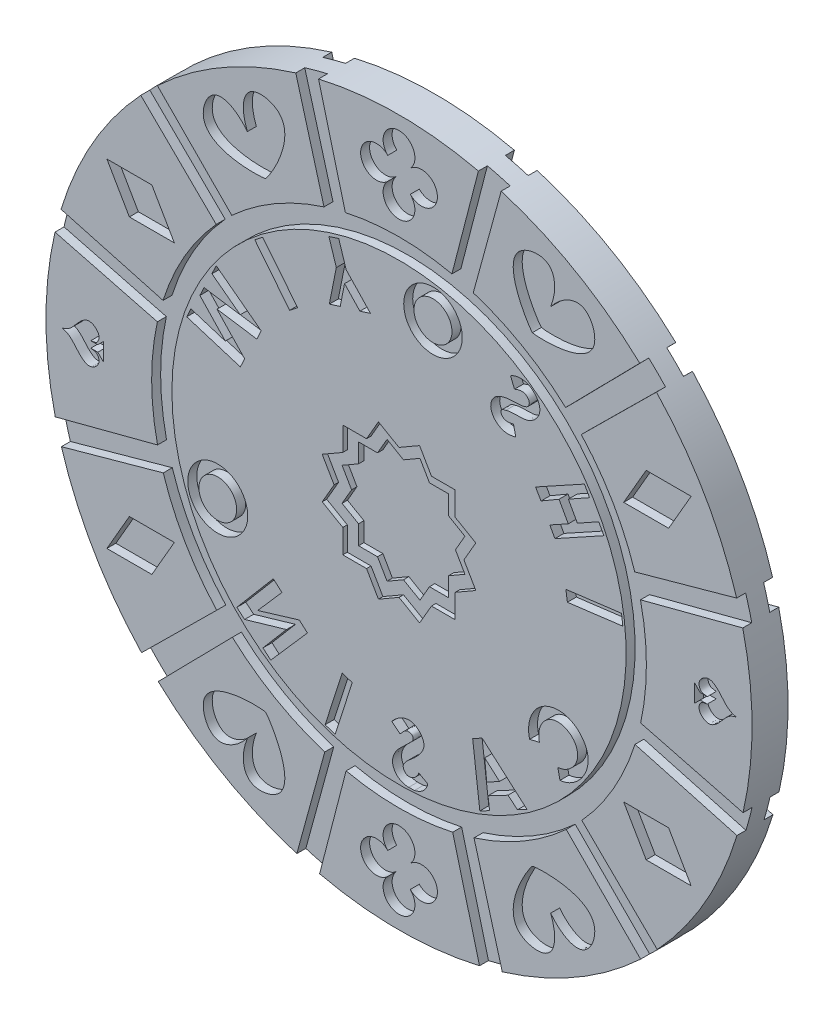
from build123d import *

# Parameters (mm, degrees)
SKETCH1_R           = 19.939
BOSS_EXTRUDE1_DEPTH = 2.032
CUT_EXTRUDE1_DEPTH  = 0.508
SKETCH3_R           = 1.693344305
SKETCH3_R_2         = 1.066307196
SKETCH3_R_3         = 1.653225877
SKETCH3_R_4         = 1.073076452
CUT_EXTRUDE2_DEPTH  = 0.508
SKETCH5_R           = 12.827
CUT_EXTRUDE3_DEPTH  = 0.508
SKETCH7_W           = 6.35
SKETCH7_H           = 6.35
CUT_EXTRUDE10_DEPTH = 0.254
SKETCH8_W           = 5.08
SKETCH8_H           = 5.08
CUT_EXTRUDE11_DEPTH = 0.3048


with BuildPart() as part:
    # Sketch1 → Boss-Extrude1 (new body)
    with BuildSketch(Plane.XY):
        Circle(SKETCH1_R)
    extrude(amount=BOSS_EXTRUDE1_DEPTH)

    # Sketch2 → Cut-Extrude1 (cut)
    with BuildSketch(Plane(origin=(0, 0, 0), x_dir=(-1, 0, 0), z_dir=(0, 0, -1))):
        Polygon((-13.957783942, 9.525), (-16.497783942, 9.525), (-15.227783942, 7.325295474), (-12.687783942, 7.325295474), align=None)
        with BuildLine():
            Line((-17.011621446, 0.182060851), (-17.408569341, 0.182060851))
            add(Edge.make_bspline(
                [(-19.05, 0), (-18.503239957, 0.097550383), (-18.264836671, 0.68419097), (-17.565831877, 1.168103901), (-17.119118499, 0.987392867), (-16.870713443, 0.631677268), (-17.05092236, 0.190580299), (-17.285542093, 0.21121167), (-17.408569341, 0.182060851)],
                knots=[0, 0, 0, 0, 0.410966466, 0.558537737, 0.671524426, 0.797338713, 0.904759417, 1, 1, 1, 1], degree=3))
            add(Edge.make_bspline(
                [(-19.05, 0), (-18.503239957, -0.097550383), (-18.264836671, -0.68419097), (-17.565831877, -1.168103901), (-17.119118499, -0.987392867), (-16.870713443, -0.631677268), (-17.05092236, -0.190580299), (-17.285542093, -0.21121167), (-17.408569341, -0.182060851)],
                knots=[0, 0, 0, 0, 0.410966466, 0.558537737, 0.671524426, 0.797338713, 0.904759417, 1, 1, 1, 1], degree=3))
            Line((-17.408569341, -0.182060851), (-17.011621446, -0.182060851))
            Line((-17.011621446, -0.182060851), (-16.67629698, -0.517385318))
            Line((-16.67629698, -0.517385318), (-16.67629698, 0.517385318))
            Line((-16.67629698, 0.517385318), (-17.011621446, 0.182060851))
        make_face()
        Polygon((13.957783942, 9.525), (12.687783942, 7.325295474), (15.227783942, 7.325295474), (16.497783942, 9.525), align=None)
        Polygon((16.497783942, -9.525), (15.227783942, -7.325295474), (12.687783942, -7.325295474), (13.957783942, -9.525), align=None)
        Polygon((-13.957783942, -9.525), (-12.687783942, -7.325295474), (-15.227783942, -7.325295474), (-16.497783942, -9.525), align=None)
        with BuildLine():
            Line((17.408569341, 0.182060851), (17.011621446, 0.182060851))
            Line((17.011621446, 0.182060851), (16.67629698, 0.517385318))
            Line((16.67629698, 0.517385318), (16.67629698, -0.517385318))
            Line((16.67629698, -0.517385318), (17.011621446, -0.182060851))
            Line((17.011621446, -0.182060851), (17.408569341, -0.182060851))
            add(Edge.make_bspline(
                [(19.05, 0), (18.503239957, -0.097550383), (18.264836671, -0.68419097), (17.565831877, -1.168103901), (17.119118499, -0.987392867), (16.870713443, -0.631677268), (17.05092236, -0.190580299), (17.285542093, -0.21121167), (17.408569341, -0.182060851)],
                knots=[0, 0, 0, 0, 0.410966466, 0.558537737, 0.671524426, 0.797338713, 0.904759417, 1, 1, 1, 1], degree=3))
            add(Edge.make_bspline(
                [(19.05, 0), (18.503239957, 0.097550383), (18.264836671, 0.68419097), (17.565831877, 1.168103901), (17.119118499, 0.987392867), (16.870713443, 0.631677268), (17.05092236, 0.190580299), (17.285542093, 0.21121167), (17.408569341, 0.182060851)],
                knots=[0, 0, 0, 0, 0.410966466, 0.558537737, 0.671524426, 0.797338713, 0.904759417, 1, 1, 1, 1], degree=3))
        make_face()
        with BuildLine():
            ThreePointArc((0.635, 17.633974816), (0, 19.167000428), (-0.635, 17.633974816))
            ThreePointArc((-0.635, 17.633974816), (-2.168025612, 16.998974816), (-0.635, 16.363974816))
            ThreePointArc((-0.635, 16.363974816), (0, 14.830949204), (0.635, 16.363974816))
            ThreePointArc((0.635, 16.363974816), (2.168025612, 16.998974816), (0.635, 17.633974816))
        make_face()
        with BuildLine():
            ThreePointArc((-0.635, -17.633974816), (0, -19.167000428), (0.635, -17.633974816))
            ThreePointArc((0.635, -17.633974816), (2.168025612, -16.998974816), (0.635, -16.363974816))
            ThreePointArc((0.635, -16.363974816), (0, -14.830949204), (-0.635, -16.363974816))
            ThreePointArc((-0.635, -16.363974816), (-2.168025612, -16.998974816), (-0.635, -17.633974816))
        make_face()
        with BuildLine():
            add(Edge.make_bspline(
                [(-8.562652515, 14.830949204), (-8.908495582, 15.69347696), (-8.807845687, 17.29380238), (-5.182637845, 16.703105549), (-7.255220808, 13.32294929), (-7.533090329, 13.047695188)],
                knots=[0, 0, 0, 0, 0.213981908, 0.428156565, 1, 1, 1, 1], degree=3))
            add(Edge.make_bspline(
                [(-8.562652515, 14.830949204), (-9.13670193, 15.561721964), (-10.572949346, 16.274719308), (-11.873994805, 12.839848807), (-7.910402134, 12.944680175), (-7.533090329, 13.047695188)],
                knots=[0, 0, 0, 0, 0.213981908, 0.428156565, 1, 1, 1, 1], degree=3))
        make_face()
        with BuildLine():
            add(Edge.make_bspline(
                [(8.562652515, 14.830949204), (9.13670193, 15.561721964), (10.572949346, 16.274719308), (11.873994805, 12.839848807), (7.910402134, 12.944680175), (7.533090329, 13.047695188)],
                knots=[0, 0, 0, 0, 0.213981908, 0.428156565, 1, 1, 1, 1], degree=3))
            add(Edge.make_bspline(
                [(8.562652515, 14.830949204), (8.908495582, 15.69347696), (8.807845687, 17.29380238), (5.182637845, 16.703105549), (7.255220808, 13.32294929), (7.533090329, 13.047695188)],
                knots=[0, 0, 0, 0, 0.213981908, 0.428156565, 1, 1, 1, 1], degree=3))
        make_face()
        with BuildLine():
            add(Edge.make_bspline(
                [(8.562652515, -14.830949204), (8.908495582, -15.69347696), (8.807845687, -17.29380238), (5.182637845, -16.703105549), (7.255220808, -13.32294929), (7.533090329, -13.047695188)],
                knots=[0, 0, 0, 0, 0.213981908, 0.428156565, 1, 1, 1, 1], degree=3))
            add(Edge.make_bspline(
                [(8.562652515, -14.830949204), (9.13670193, -15.561721964), (10.572949346, -16.274719308), (11.873994805, -12.839848807), (7.910402134, -12.944680175), (7.533090329, -13.047695188)],
                knots=[0, 0, 0, 0, 0.213981908, 0.428156565, 1, 1, 1, 1], degree=3))
        make_face()
        with BuildLine():
            add(Edge.make_bspline(
                [(-8.562652515, -14.830949204), (-9.13670193, -15.561721964), (-10.572949346, -16.274719308), (-11.873994805, -12.839848807), (-7.910402134, -12.944680175), (-7.533090329, -13.047695188)],
                knots=[0, 0, 0, 0, 0.213981908, 0.428156565, 1, 1, 1, 1], degree=3))
            add(Edge.make_bspline(
                [(-8.562652515, -14.830949204), (-8.908495582, -15.69347696), (-8.807845687, -17.29380238), (-5.182637845, -16.703105549), (-7.255220808, -13.32294929), (-7.533090329, -13.047695188)],
                knots=[0, 0, 0, 0, 0.213981908, 0.428156565, 1, 1, 1, 1], degree=3))
        make_face()
    cut_extrude1 = extrude(amount=-CUT_EXTRUDE1_DEPTH, mode=Mode.SUBTRACT)

    # Sketch3 → Cut-Extrude2 (cut)
    # profile 1 of 14: a face of its own
    with BuildSketch(Plane(origin=(0, 0, 0), x_dir=(-1, 0, 0), z_dir=(0, 0, -1))):
        Polygon((-4.696646067, -8.204357582), (-7.240078721, -10.434139165), (-6.691238191, -10.707417204), (-6.15526884, -10.265242489), (-5.027772466, -10.857780737), (-5.114393173, -11.541680622), (-4.56389696, -11.830985376), (-4.158368315, -8.487241113), align=None)
        Polygon((-5.677931081, -9.829778777), (-4.839145066, -9.094430191), (-4.954001902, -10.230696702), align=None, mode=Mode.SUBTRACT)
    # profile 2 of 14: a face of its own
    with BuildSketch(Plane(origin=(0, 0, 0), x_dir=(-1, 0, 0), z_dir=(0, 0, -1))):
        Polygon((10.566106596, 6.876775357), (10.325836185, 7.393720787), (7.783544683, 5.476843931), (8.02800643, 4.950880778), (10.278120825, 5.288851587), (8.718721021, 3.641886888), (8.96016825, 3.122409516), (11.986108925, 4.061741811), (11.749483233, 4.570845574), (9.811153995, 3.961137561), (11.24627414, 5.476843931), (11.01308478, 5.978554373), (8.967286983, 5.671272246), align=None)
    # profile 3 of 14: a face of its own
    with BuildSketch(Plane(origin=(0, 0, 0), x_dir=(-1, 0, 0), z_dir=(0, 0, -1))):
        Polygon((-12.566598854, 1.835917547), (-12.63886492, 1.244625866), (-9.508901766, 0.848001087), (-9.424548501, 1.438473947), align=None)
    # profile 4 of 14: a face of its own
    with BuildSketch(Plane(origin=(0, 0, 0), x_dir=(-1, 0, 0), z_dir=(0, 0, -1))):
        with BuildLine():
            add(Edge.make_bspline(
                [(-0.877004714, -12.669682819), (-1.223168646, -12.605473738), (-1.525098352, -12.395228719), (-1.626085569, -11.983153203)],
                knots=[0.817657681, 0.817657681, 0.817657681, 0.817657681, 1, 1, 1, 1], degree=3))
            ThreePointArc((-0.877004714, -12.669682819), (-0.708481235, -12.680222961), (-0.539832519, -12.688521618))
            add(Edge.make_bspline(
                [(-0.056107542, -10.314269769), (-0.184544395, -10.21683942), (-0.317230485, -9.901866491), (-0.820670158, -9.99140543), (-0.802936141, -10.287034293), (-0.686873755, -10.392351784), (-0.560480958, -10.52839168), (-0.311783841, -10.759848149), (0.134737172, -11.141969565), (0.509933343, -11.851693459), (0.096866017, -12.557013264), (-0.326788553, -12.675041211), (-0.539832519, -12.688521618)],
                knots=[0, 0, 0, 0, 0.088514071, 0.149178464, 0.191359136, 0.208149036, 0.230553514, 0.288249893, 0.384429529, 0.542473138, 0.651548097, 0.759918398, 0.759918398, 0.759918398, 0.759918398], degree=3))
            Line((-0.056107542, -10.314269769), (0.408335348, -9.938092506))
            add(Edge.make_bspline(
                [(-1.110554812, -11.688781165), (-1.086307137, -11.922609617), (-0.517662431, -12.402985932), (-0.184456029, -11.848954335), (-0.343369801, -11.529096682), (-0.70395255, -11.221610767), (-1.161929526, -10.826038043), (-1.490992496, -10.248450558), (-1.254232985, -9.683036106), (-0.539503588, -9.155302754), (0.171116843, -9.627778317), (0.408335348, -9.938092506)],
                knots=[0, 0, 0, 0, 0.15376534, 0.22433551, 0.249996827, 0.337815179, 0.471408533, 0.579285506, 0.655102445, 0.776980253, 1, 1, 1, 1], degree=3))
            Line((-1.110554812, -11.688781165), (-1.626085569, -11.983153203))
        make_face()
    # profile 5 of 14: a face of its own
    with BuildSketch(Plane(origin=(0, 0, 0), x_dir=(-1, 0, 0), z_dir=(0, 0, -1))):
        with BuildLine():
            add(Edge.make_bspline(
                [(-7.677354711, 10.116729938), (-7.56726182, 10.239021222), (-7.437358551, 10.336210304), (-7.290700027, 10.398831334)],
                knots=[0.672725228, 0.672725228, 0.672725228, 0.672725228, 0.776938176, 0.776938176, 0.776938176, 0.776938176], degree=3))
            ThreePointArc((-7.677354711, 10.116729938), (-7.485356435, 10.259602285), (-7.290700027, 10.398831334))
        make_face()
    # profile 6 of 14: a face of its own
    with BuildSketch(Plane(origin=(0, 0, 0), x_dir=(-1, 0, 0), z_dir=(0, 0, -1))):
        with BuildLine():
            ThreePointArc((-7.290700027, 10.398831334), (-7.485356435, 10.259602285), (-7.677354711, 10.116729938))
            add(Edge.make_bspline(
                [(-6.02636145, 8.49410492), (-6.423893454, 8.627857884), (-7.145842344, 8.425201888), (-7.832054615, 8.961025733), (-8.028852186, 9.562671674), (-7.842043942, 9.933792989), (-7.677354711, 10.116729938)],
                knots=[0, 0, 0, 0, 0.27711955, 0.430763444, 0.516831873, 0.672725228, 0.672725228, 0.672725228, 0.672725228], degree=3))
            add(Edge.make_bspline(
                [(-6.468617691, 8.042910061), (-6.308464714, 8.0055699), (-5.861711714, 7.871207764), (-5.603369372, 8.439994053), (-6.02636145, 8.49410492)],
                knots=[0, 0, 0, 0, 0.448974399, 1, 1, 1, 1], degree=3))
            Line((-6.468617691, 8.042910061), (-6.592178635, 7.464092988))
            add(Edge.make_bspline(
                [(-6.52189915, 9.775101937), (-6.666394745, 9.843130685), (-6.877645542, 9.906400562), (-7.13956487, 9.850891665), (-7.244214111, 9.760836581), (-7.322350622, 9.663058465), (-7.36678207, 9.550301655), (-7.348164339, 9.427743085), (-7.295375315, 9.300384157), (-7.148818379, 9.223703456), (-6.889308433, 9.161700607), (-6.263434313, 9.156373615), (-5.384239452, 9.051347772), (-5.130925486, 8.30689123), (-5.314066653, 7.725314444), (-5.852671424, 7.376123406), (-6.334203462, 7.410280635), (-6.521326918, 7.448968166), (-6.592178635, 7.464092988)],
                knots=[0, 0, 0, 0, 0.085957681, 0.111215078, 0.138604983, 0.157059125, 0.177811664, 0.200582468, 0.22142463, 0.248361118, 0.283662464, 0.363273695, 0.5882625, 0.668484462, 0.745864952, 0.899069615, 0.961119143, 1, 1, 1, 1], degree=3))
            Line((-6.52189915, 9.775101937), (-6.299247122, 10.31737309))
            add(Edge.make_bspline(
                [(-7.290700027, 10.398831334), (-6.976785887, 10.53286805), (-6.586107644, 10.508531445), (-6.299247122, 10.31737309)],
                knots=[0.776938176, 0.776938176, 0.776938176, 0.776938176, 1, 1, 1, 1], degree=3))
        make_face()
    # profile 7 of 14: a face of its own
    with BuildSketch(Plane(origin=(0, 0, 0), x_dir=(-1, 0, 0), z_dir=(0, 0, -1))):
        Polygon((8.142555768, 9.74621904), (7.701763529, 10.098160156), (5.721346376, 7.635468533), (6.176630389, 7.283975761), align=None)
    # profile 8 of 14: a face of its own
    with BuildSketch(Plane(origin=(0, 0, 0), x_dir=(-1, 0, 0), z_dir=(0, 0, -1))):
        with BuildLine():
            Line((-9.090445967, -8.071824904), (-8.970425401, -7.495288304))
            add(Edge.make_bspline(
                [(-8.970425401, -7.495288304), (-9.517907254, -7.472486433), (-10.269845458, -6.758366521), (-9.92317436, -5.555629926), (-9.066678946, -5.152412498), (-8.371791566, -5.415680018), (-8.005932923, -5.830545665), (-7.869844474, -6.331386671), (-7.900631309, -6.666518401), (-7.931926985, -6.794461079)],
                knots=[0, 0, 0, 0, 0.300665346, 0.426683303, 0.634981994, 0.725338812, 0.818543277, 0.92754792, 1, 1, 1, 1], degree=3))
            Line((-7.931926985, -6.794461079), (-7.378445567, -6.918179715))
            add(Edge.make_bspline(
                [(-9.090445967, -8.071824904), (-9.5972613, -8.022173868), (-10.386621437, -7.504020185), (-10.833441935, -6.235759991), (-10.323938644, -5.157151285), (-9.265396428, -4.528606351), (-7.603194969, -4.929734474), (-7.190784112, -6.237260312), (-7.378445567, -6.918179715)],
                knots=[0, 0, 0, 0, 0.179528127, 0.326334828, 0.445822421, 0.586433368, 0.743646643, 1, 1, 1, 1], degree=3))
        make_face()
    # profile 9 of 14: a face of its own
    with BuildSketch(Plane(origin=(0, 0, 0), x_dir=(-1, 0, 0), z_dir=(0, 0, -1))):
        Polygon((3.208116244, -8.977260039), (2.641435688, -9.154094836), (3.602974073, -12.166224529), (4.173185065, -11.983153203), align=None)
    # profile 10 of 14: a face of its own
    with BuildSketch(Plane(origin=(0, 0, 0), x_dir=(-1, 0, 0), z_dir=(0, 0, -1))):
        Polygon((5.170544081, -7.993719459), (7.243876471, -10.361738686), (7.681553975, -9.978527716), (6.357193688, -8.418704219), (8.718721021, -9.106958967), (9.159115297, -8.733044424), (7.098316247, -6.305847829), (6.60993247, -6.733454958), (7.980593564, -8.298930826), (5.631629203, -7.590013818), align=None)
    # profile 11 of 14: a face of its own
    with BuildSketch(Plane(origin=(0, 0, 0), x_dir=(-1, 0, 0), z_dir=(0, 0, -1))):
        Polygon((-11.278061395, 5.668713091), (-11.572149384, 5.135554239), (-8.805351698, 3.609401269), (-8.516502531, 4.133062541), (-9.557271935, 4.707146192), (-9.036887233, 5.650563542), (-8.020213392, 5.058154902), (-7.711641305, 5.587717011), (-10.474957987, 7.111949875), (-10.762896333, 6.589939851), (-9.563722922, 5.919342477), (-10.071977702, 4.997915741), align=None)
    # profile 12 of 14: a face of its own
    with BuildSketch(Plane(origin=(0, 0, 0), x_dir=(-1, 0, 0), z_dir=(0, 0, -1))):
        Polygon((3.075049426, 10.141068652), (3.320132657, 8.902040058), (3.935987567, 8.706519267), (3.541002846, 10.690532482), (3.958154486, 12.004484234), (3.403244931, 12.180656175), (2.986093291, 10.866704423), (1.611982139, 9.415432881), (2.208639243, 9.226006984), align=None)
    # profile 13 of 14: a face of its own
    with BuildSketch(Plane(origin=(0, 0, 0), x_dir=(-1, 0, 0), z_dir=(0, 0, -1))):
        with Locations((10.236453202, -3.955024513)):
            Circle(SKETCH3_R)
        with Locations((10.236453202, -3.955024513)):
            Circle(SKETCH3_R_2, mode=Mode.SUBTRACT)
    # profile 14 of 14: a face of its own
    with BuildSketch(Plane(origin=(0, 0, 0), x_dir=(-1, 0, 0), z_dir=(0, 0, -1))):
        with Locations((-1.918843547, 10.824202152)):
            Circle(SKETCH3_R_3)
        with Locations((-1.918843547, 10.824202152)):
            Circle(SKETCH3_R_4, mode=Mode.SUBTRACT)
    cut_extrude2 = extrude(amount=-CUT_EXTRUDE2_DEPTH, mode=Mode.SUBTRACT)

    # Sketch5 → Cut-Extrude3 (cut)
    with BuildSketch(Plane(origin=(0, 0, 0), x_dir=(-1, 0, 0), z_dir=(0, 0, -1))):
        with BuildLine():
            Line((-13.312396864, 4.235680551), (-19.293517664, 5.893175988))
            ThreePointArc((-19.293517664, 5.893175988), (-19.477803533, 5.252096399), (-19.640794094, 4.605274632))
            Line((-19.640794094, 4.605274632), (-13.637193468, 3.031147359))
            ThreePointArc((-13.637193468, 3.031147359), (-13.969982524, 0.022096798), (-13.646714145, -2.987991473))
            Line((-13.646714145, -2.987991473), (-19.655264419, -4.543118717))
            ThreePointArc((-19.655264419, -4.543118717), (-19.494320869, -5.190452862), (-19.312063952, -5.832112224))
            Line((-19.312063952, -5.832112224), (-13.325729659, -4.193546118))
            ThreePointArc((-13.325729659, -4.193546118), (-12.109408155, -6.965854874), (-10.324405392, -9.411033594))
            Line((-10.324405392, -9.411033594), (-14.750398947, -13.762088431))
            ThreePointArc((-14.750398947, -13.762088431), (-14.287350672, -14.24222447), (-13.80868187, -14.706789319))
            Line((-13.80868187, -14.706789319), (-9.44364735, -10.2945823))
            ThreePointArc((-9.44364735, -10.2945823), (-7.00412765, -12.087311358), (-4.235680551, -13.312396864))
            Line((-4.235680551, -13.312396864), (-5.893175988, -19.293517664))
            ThreePointArc((-5.893175988, -19.293517664), (-5.252096399, -19.477803533), (-4.605274632, -19.640794094))
            Line((-4.605274632, -19.640794094), (-3.031147359, -13.637193468))
            ThreePointArc((-3.031147359, -13.637193468), (-0.022096798, -13.969982524), (2.987991473, -13.646714145))
            Line((2.987991473, -13.646714145), (4.543118717, -19.655264419))
            ThreePointArc((4.543118717, -19.655264419), (5.190452862, -19.494320869), (5.832112224, -19.312063952))
            Line((5.832112224, -19.312063952), (4.193546118, -13.325729659))
            ThreePointArc((4.193546118, -13.325729659), (6.965854874, -12.109408155), (9.411033594, -10.324405392))
            Line((9.411033594, -10.324405392), (13.762088431, -14.750398947))
            ThreePointArc((13.762088431, -14.750398947), (14.24222447, -14.287350672), (14.706789319, -13.80868187))
            Line((14.706789319, -13.80868187), (10.2945823, -9.44364735))
            ThreePointArc((10.2945823, -9.44364735), (12.087311358, -7.00412765), (13.312396864, -4.235680551))
            Line((13.312396864, -4.235680551), (19.293517664, -5.893175988))
            ThreePointArc((19.293517664, -5.893175988), (19.477803533, -5.252096399), (19.640794094, -4.605274632))
            Line((19.640794094, -4.605274632), (13.637193468, -3.031147359))
            ThreePointArc((13.637193468, -3.031147359), (13.969982524, -0.022096798), (13.646714145, 2.987991473))
            Line((13.646714145, 2.987991473), (19.655264419, 4.543118717))
            ThreePointArc((19.655264419, 4.543118717), (19.494320869, 5.190452862), (19.312063952, 5.832112224))
            Line((19.312063952, 5.832112224), (13.325729659, 4.193546118))
            ThreePointArc((13.325729659, 4.193546118), (12.109408155, 6.965854874), (10.324405392, 9.411033594))
            Line((10.324405392, 9.411033594), (14.750398947, 13.762088431))
            ThreePointArc((14.750398947, 13.762088431), (14.287350672, 14.24222447), (13.80868187, 14.706789319))
            Line((13.80868187, 14.706789319), (9.44364735, 10.2945823))
            ThreePointArc((9.44364735, 10.2945823), (7.00412765, 12.087311358), (4.235680551, 13.312396864))
            Line((4.235680551, 13.312396864), (5.893175988, 19.293517664))
            ThreePointArc((5.893175988, 19.293517664), (5.252096399, 19.477803533), (4.605274632, 19.640794094))
            Line((4.605274632, 19.640794094), (3.031147359, 13.637193468))
            ThreePointArc((3.031147359, 13.637193468), (0.022096798, 13.969982524), (-2.987991473, 13.646714145))
            Line((-2.987991473, 13.646714145), (-4.543118717, 19.655264419))
            ThreePointArc((-4.543118717, 19.655264419), (-5.190452862, 19.494320869), (-5.832112224, 19.312063952))
            Line((-5.832112224, 19.312063952), (-4.193546118, 13.325729659))
            ThreePointArc((-4.193546118, 13.325729659), (-6.965854874, 12.109408155), (-9.411033594, 10.324405392))
            Line((-9.411033594, 10.324405392), (-13.762088431, 14.750398947))
            ThreePointArc((-13.762088431, 14.750398947), (-14.24222447, 14.287350672), (-14.706789319, 13.80868187))
            Line((-14.706789319, 13.80868187), (-10.2945823, 9.44364735))
            ThreePointArc((-10.2945823, 9.44364735), (-12.087311358, 7.00412765), (-13.312396864, 4.235680551))
        make_face()
        Circle(SKETCH5_R, mode=Mode.SUBTRACT)
    cut_extrude3 = extrude(amount=-CUT_EXTRUDE3_DEPTH, mode=Mode.SUBTRACT)

    # Sketch7 → Cut-Extrude10 (cut)
    with BuildSketch(Plane(origin=(0, 0, 0), x_dir=(-1, 0, 0), z_dir=(0, 0, -1))):
        Polygon((-3.175, -1.833087105), (-3.175, -0.850738686), (-3.666174209, 0), (-4.337130657, -1.162130657), align=None)
        Polygon((-3.175, 0.850738686), (-3.175, 1.833087105), (-4.337130657, 1.162130657), (-3.666174209, 0), align=None)
        Polygon((-3.175, 1.833087105), (-2.324261314, 2.324261314), (-1.833087105, 3.175), (-3.175, 3.175), align=None)
        Polygon((-0.850738686, 3.175), (0, 3.666174209), (-1.162130657, 4.337130657), (-1.833087105, 3.175), align=None)
        Polygon((1.833087105, 3.175), (1.162130657, 4.337130657), (0, 3.666174209), (0.850738686, 3.175), align=None)
        Polygon((3.175, 3.175), (1.833087105, 3.175), (2.324261314, 2.324261314), (3.175, 1.833087105), align=None)
        Polygon((4.337130657, 1.162130657), (3.175, 1.833087105), (3.175, 0.850738686), (3.666174209, 0), align=None)
        Polygon((3.666174209, 0), (3.175, -0.850738686), (3.175, -1.833087105), (4.337130657, -1.162130657), align=None)
        Polygon((3.175, -3.175), (3.175, -1.833087105), (2.324261314, -2.324261314), (1.833087105, -3.175), align=None)
        Polygon((1.833087105, -3.175), (0.850738686, -3.175), (0, -3.666174209), (1.162130657, -4.337130657), align=None)
        Polygon((-0.850738686, -3.175), (-1.833087105, -3.175), (-1.162130657, -4.337130657), (0, -3.666174209), align=None)
        Polygon((-2.324261314, -2.324261314), (-3.175, -1.833087105), (-3.175, -3.175), (-1.833087105, -3.175), align=None)
        Polygon((-2.324261314, -2.324261314), (-3.175, -0.850738686), (-3.175, -1.833087105), align=None)
        Polygon((-3.175, 0.850738686), (-2.324261314, 2.324261314), (-3.175, 1.833087105), align=None)
        Polygon((-3.175, -0.850738686), (-3.175, 0.850738686), (-3.666174209, 0), align=None)
        Polygon((1.162130657, 4.337130657), (-4.337130657, 1.162130657), (-1.162130657, -4.337130657), (4.337130657, -1.162130657), align=None)
        Polygon((-1.162130657, 4.337130657), (-4.337130657, -1.162130657), (1.162130657, -4.337130657), (4.337130657, 1.162130657), align=None)
        Rectangle(SKETCH7_W, SKETCH7_H)
        Polygon((3.175, -1.833087105), (3.175, -0.850738686), (2.324261314, -2.324261314), align=None)
        Polygon((1.833087105, -3.175), (2.324261314, -2.324261314), (0.850738686, -3.175), align=None)
        Polygon((-0.850738686, -3.175), (-2.324261314, -2.324261314), (-1.833087105, -3.175), align=None)
        Polygon((0.850738686, 3.175), (0, 3.666174209), (-0.850738686, 3.175), align=None)
        Polygon((-2.324261314, 2.324261314), (-0.850738686, 3.175), (-1.833087105, 3.175), align=None)
        Polygon((2.324261314, 2.324261314), (1.833087105, 3.175), (0.850738686, 3.175), align=None)
        Polygon((3.175, 1.833087105), (2.324261314, 2.324261314), (3.175, 0.850738686), align=None)
        Polygon((3.666174209, 0), (3.175, 0.850738686), (3.175, -0.850738686), align=None)
        Polygon((0, -3.666174209), (0.850738686, -3.175), (-0.850738686, -3.175), align=None)
    cut_extrude10 = extrude(amount=-CUT_EXTRUDE10_DEPTH, mode=Mode.SUBTRACT)

    # Sketch8 → Cut-Extrude11 (cut)
    with BuildSketch(Plane(origin=(0, 0, 0.254), x_dir=(-1, 0, 0), z_dir=(0, 0, -1))):
        Polygon((0.929704526, 3.469704526), (-3.469704526, 0.929704526), (-0.929704526, -3.469704526), (3.469704526, -0.929704526), align=None)
        Rectangle(SKETCH8_W, SKETCH8_H)
        Polygon((3.469704526, 0.929704526), (-0.929704526, 3.469704526), (-3.469704526, -0.929704526), (0.929704526, -3.469704526), align=None)
    cut_extrude11 = extrude(amount=-CUT_EXTRUDE11_DEPTH, mode=Mode.SUBTRACT)

    # Mirror3: Cut-Extrude1, Cut-Extrude2, Cut-Extrude3, Cut-Extrude10, Cut-Extrude11 across plane
    add(cut_extrude1.mirror(Plane(origin=(0, 0, 1.016), x_dir=(1, 0, 0), z_dir=(0, 0, -1))), mode=Mode.SUBTRACT)
    add(cut_extrude2.mirror(Plane(origin=(0, 0, 1.016), x_dir=(1, 0, 0), z_dir=(0, 0, -1))), mode=Mode.SUBTRACT)
    add(cut_extrude3.mirror(Plane(origin=(0, 0, 1.016), x_dir=(1, 0, 0), z_dir=(0, 0, -1))), mode=Mode.SUBTRACT)
    add(cut_extrude10.mirror(Plane(origin=(0, 0, 1.016), x_dir=(1, 0, 0), z_dir=(0, 0, -1))), mode=Mode.SUBTRACT)
    add(cut_extrude11.mirror(Plane(origin=(0, 0, 1.016), x_dir=(1, 0, 0), z_dir=(0, 0, -1))), mode=Mode.SUBTRACT)


solid = part.part
